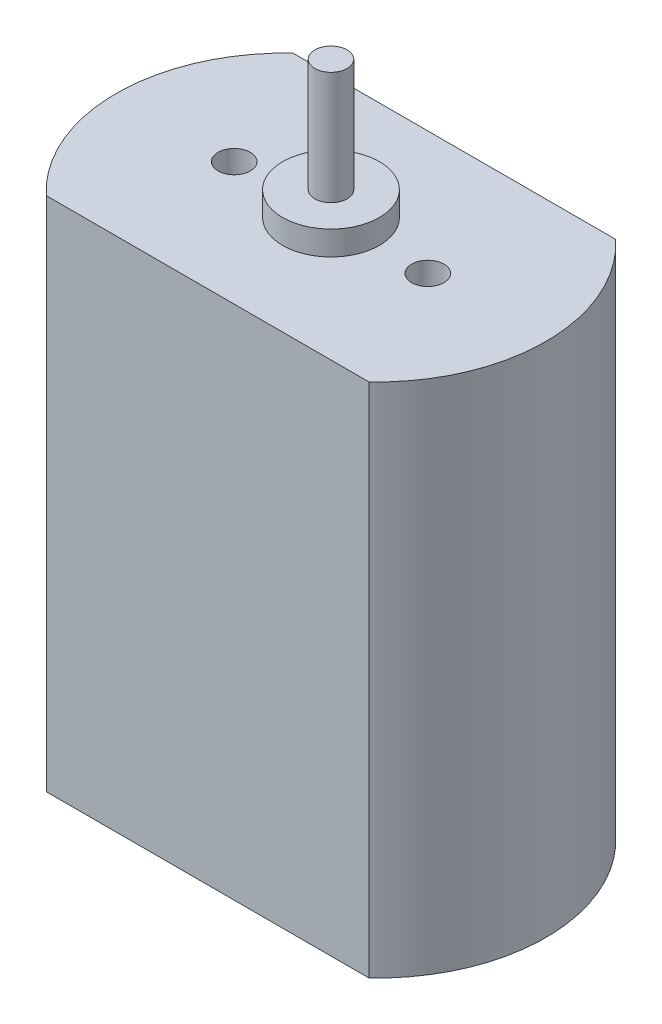
from build123d import *

# Parameters (mm, degrees)
EXTRUDE_1_DEPTH     = 32
SKETCH_2_R          = 3
EXTRUDE_2_DEPTH     = 1.5
SKETCH_3_R          = 1
CUT_EXTRUDE_1_DEPTH = 1.5
SKETCH_4_R          = 1
EXTRUDE_3_DEPTH     = 7


with BuildPart() as part:
    # 草图1 → 凸台-拉伸1 (new body)
    with BuildSketch(Plane(origin=(0, 0, 0), x_dir=(1, 0, 0), z_dir=(0, 1, 0))):
        with BuildLine():
            Line((-10, 7.65), (10, 7.65))
            ThreePointArc((10, 7.65), (13.31807086, 0), (10, -7.65))
            Line((10, -7.65), (-10, -7.65))
            ThreePointArc((-10, -7.65), (-13.31807086, 0), (-10, 7.65))
        make_face()
    extrude(amount=EXTRUDE_1_DEPTH)

    # 草图2 → 凸台-拉伸2 (add)
    with BuildSketch(Plane(origin=(0, 32, 0), x_dir=(1, 0, 0), z_dir=(0, 1, 0))):
        with Locations(Location((0, 0, 0), (0, 0, 270))):
            Circle(SKETCH_2_R)
    extrude(amount=EXTRUDE_2_DEPTH)

    # 草图3 → 切除-拉伸1 (cut)
    with BuildSketch(Plane(origin=(0, 32, 0), x_dir=(1, 0, 0), z_dir=(0, 1, 0))):
        with Locations(Location((-6, 0, 0), (0, 0, 270))):
            Circle(SKETCH_3_R)
        with Locations(Location((6, 0, 0), (0, 0, 270))):
            Circle(SKETCH_3_R)
    extrude(amount=-CUT_EXTRUDE_1_DEPTH, mode=Mode.SUBTRACT)

    # 草图4 → 凸台-拉伸3 (add)
    with BuildSketch(Plane(origin=(0, 33.5, 0), x_dir=(1, 0, 0), z_dir=(0, 1, 0))):
        with Locations(Location((0, 0, 0), (0, 0, 270))):
            Circle(SKETCH_4_R)
    extrude(amount=EXTRUDE_3_DEPTH)


solid = part.part
